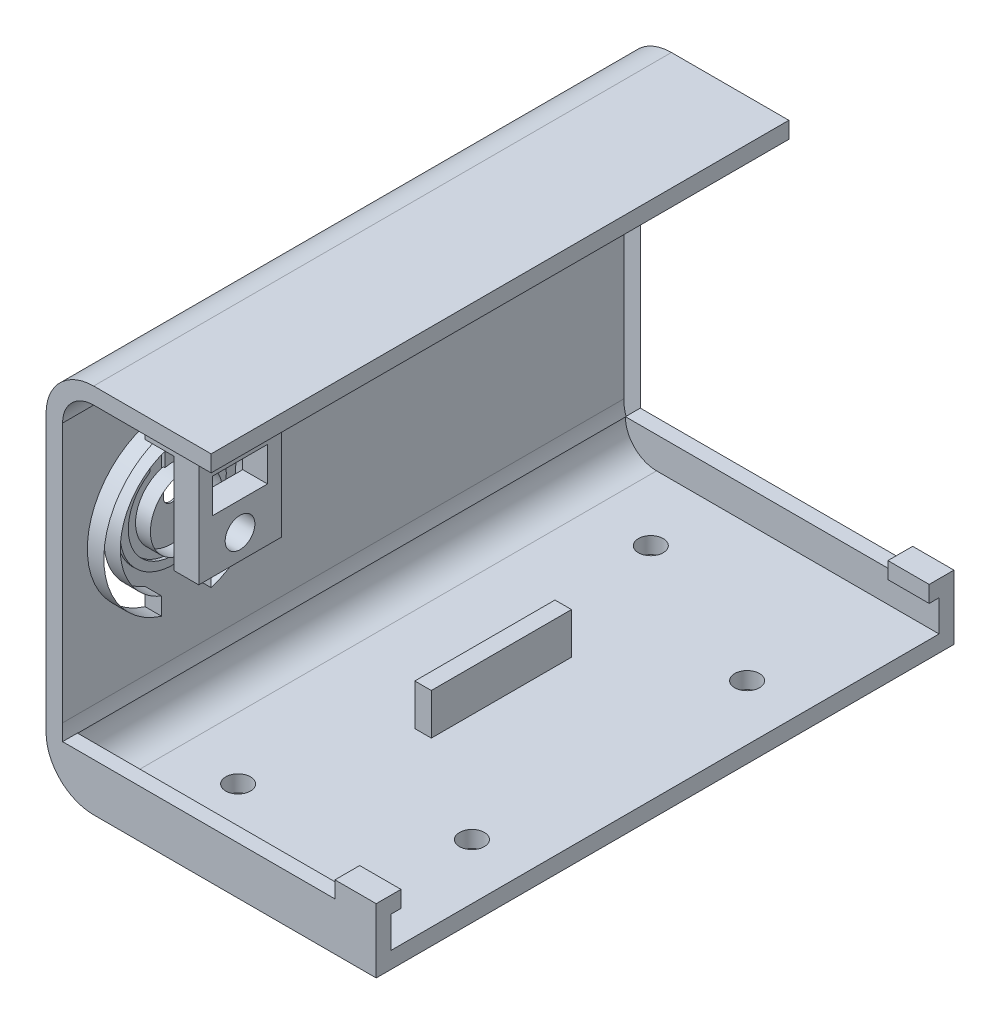
from build123d import *

# Parameters (mm, degrees)
BOSS_EXTRUDE1_DEPTH = 70
BOSS_EXTRUDE3_REACH = 86.63
SKETCH3_W           = 1.8
SKETCH3_H           = 3.8
SKETCH4_W           = 5
SKETCH4_H           = 3
BOSS_EXTRUDE4_DEPTH = 2
CUT_EXTRUDE1_REACH  = 90.595
SKETCH5_R           = 1.5
SKETCH7_R           = 10
CUT_EXTRUDE2_DEPTH  = 85.630140132
BOSS_EXTRUDE5_DEPTH = 2
SKETCH10_R          = 4.358893906
CUT_EXTRUDE3_DEPTH  = 1.8
SKETCH9_R           = 1.5
BOSS_EXTRUDE6_DEPTH = 2
SKETCH11_W          = 10
SKETCH11_H          = 3
BOSS_EXTRUDE7_DEPTH = 3.5
SKETCH12_W          = 10
SKETCH12_H          = 15
BOSS_EXTRUDE8_DEPTH = 3
CUT_EXTRUDE4_REACH  = 82.96
SKETCH13_W          = 6.66
SKETCH13_H          = 4.15
CUT_EXTRUDE5_REACH  = 82.96
SKETCH15_R          = 1.8
CUT_EXTRUDE6_DEPTH  = 0.4
SKETCH17_W          = 2
SKETCH17_H          = 16.984057064
BOSS_EXTRUDE9_DEPTH = 5


with BuildPart() as part:
    # Sketch1 → Boss-Extrude1 (new body)
    with BuildSketch(Plane.XY):
        with BuildLine():
            Line((-30.398230088, 19.964424779), (-30.398230088, -13.495575221))
            ThreePointArc((-30.398230088, -13.495575221), (-28.708236216, -17.575581349), (-24.628230088, -19.265575221))
            Line((-24.628230088, -19.265575221), (9.601769912, -19.265575221))
            Line((9.601769912, -19.265575221), (9.601769912, -17.265575221))
            Line((9.601769912, -17.265575221), (-24.628230088, -17.265575221))
            ThreePointArc((-24.628230088, -17.265575221), (-27.294022654, -16.161367786), (-28.398230088, -13.495575221))
            Line((-28.398230088, -13.495575221), (-28.398230088, 19.964424779))
            ThreePointArc((-28.398230088, 19.964424779), (-27.294022654, 22.630217344), (-24.628230088, 23.734424779))
            Line((-24.628230088, 23.734424779), (-10.398230088, 23.734424779))
            Line((-10.398230088, 23.734424779), (-10.398230088, 25.734424779))
            Line((-10.398230088, 25.734424779), (-24.628230088, 25.734424779))
            ThreePointArc((-24.628230088, 25.734424779), (-28.708236216, 24.044430906), (-30.398230088, 19.964424779))
        make_face()
    extrude(amount=BOSS_EXTRUDE1_DEPTH)

    # Sketch3 → Boss-Extrude3 (add, up to next)
    with BuildSketch(Plane(origin=(9.601769912, 0, 0), x_dir=(0, 0, -1), z_dir=(1, 0, 0)), mode=Mode.PRIVATE) as boss_extrude3_sk1:
        with Locations((-69.1, -15.365575221)):
            Rectangle(SKETCH3_W, SKETCH3_H)
    boss_extrude3_tool1 = extrude(boss_extrude3_sk1.sketch, amount=-BOSS_EXTRUDE3_REACH, mode=Mode.PRIVATE) - part.part
    # Sketch3 → Boss-Extrude3 (add, up to next)
    with BuildSketch(Plane(origin=(9.601769912, 0, 0), x_dir=(0, 0, -1), z_dir=(1, 0, 0)), mode=Mode.PRIVATE) as boss_extrude3_sk2:
        with Locations((-0.9, -15.365575221)):
            Rectangle(SKETCH3_W, SKETCH3_H)
    boss_extrude3_tool2 = extrude(boss_extrude3_sk2.sketch, amount=-BOSS_EXTRUDE3_REACH, mode=Mode.PRIVATE) - part.part
    add(boss_extrude3_tool1.solids().sort_by_distance((9.60177, -15.365575, 69.1))[0])
    add(boss_extrude3_tool2.solids().sort_by_distance((9.60177, -15.365575, 0.9))[0])

    # Sketch4 → Boss-Extrude4 (add)
    with BuildSketch(Plane(origin=(0, -13.465575221, 0), x_dir=(1, 0, 0), z_dir=(0, 1, 0))):
        with Locations((7.101769912, -68.5)):
            Rectangle(SKETCH4_W, SKETCH4_H)
        with Locations((7.101769912, -1.5)):
            Rectangle(SKETCH4_W, SKETCH4_H)
    extrude(amount=BOSS_EXTRUDE4_DEPTH)

    # Sketch5 → Cut-Extrude1 (cut, up to next)
    with BuildSketch(Plane(origin=(0, -19.265575221, 0), x_dir=(-1, 0, 0), z_dir=(0, -1, 0)), mode=Mode.PRIVATE) as cut_extrude1_sk1:
        with Locations((17.128230088, -60)):
            Circle(SKETCH5_R)
    cut_extrude1_tool1 = extrude(cut_extrude1_sk1.sketch, amount=-CUT_EXTRUDE1_REACH, mode=Mode.PRIVATE) & part.part
    # Sketch5 → Cut-Extrude1 (cut, up to next)
    with BuildSketch(Plane(origin=(0, -19.265575221, 0), x_dir=(-1, 0, 0), z_dir=(0, -1, 0)), mode=Mode.PRIVATE) as cut_extrude1_sk2:
        with Locations((17.128230088, -10)):
            Circle(SKETCH5_R)
    cut_extrude1_tool2 = extrude(cut_extrude1_sk2.sketch, amount=-CUT_EXTRUDE1_REACH, mode=Mode.PRIVATE) & part.part
    # Sketch5 → Cut-Extrude1 (cut, up to next)
    with BuildSketch(Plane(origin=(0, -19.265575221, 0), x_dir=(-1, 0, 0), z_dir=(0, -1, 0)), mode=Mode.PRIVATE) as cut_extrude1_sk3:
        with Locations((-2.871769912, -51.67)):
            Circle(SKETCH5_R)
    cut_extrude1_tool3 = extrude(cut_extrude1_sk3.sketch, amount=-CUT_EXTRUDE1_REACH, mode=Mode.PRIVATE) & part.part
    # Sketch5 → Cut-Extrude1 (cut, up to next)
    with BuildSketch(Plane(origin=(0, -19.265575221, 0), x_dir=(-1, 0, 0), z_dir=(0, -1, 0)), mode=Mode.PRIVATE) as cut_extrude1_sk4:
        with Locations((-2.871769912, -18.33)):
            Circle(SKETCH5_R)
    cut_extrude1_tool4 = extrude(cut_extrude1_sk4.sketch, amount=-CUT_EXTRUDE1_REACH, mode=Mode.PRIVATE) & part.part
    add(cut_extrude1_tool1.solids().sort_by_distance((-17.12823, -19.265575, 60))[0], mode=Mode.SUBTRACT)
    add(cut_extrude1_tool2.solids().sort_by_distance((-17.12823, -19.265575, 10))[0], mode=Mode.SUBTRACT)
    add(cut_extrude1_tool3.solids().sort_by_distance((2.87177, -19.265575, 51.67))[0], mode=Mode.SUBTRACT)
    add(cut_extrude1_tool4.solids().sort_by_distance((2.87177, -19.265575, 18.33))[0], mode=Mode.SUBTRACT)

    # Sketch7 → Cut-Extrude2 (cut, through all)
    with BuildSketch(Plane.ZY.offset(30.398230088)):
        with Locations((55, 3.234424779)):
            Circle(SKETCH7_R)
    extrude(amount=-CUT_EXTRUDE2_DEPTH, mode=Mode.SUBTRACT)

    # Sketch8 → Boss-Extrude5 (add)
    with BuildSketch(Plane.ZY.offset(30.398230088)):
        with BuildLine():
            Line((52, -4.181773708), (52, -6.304967235))
            ThreePointArc((52, -6.304967235), (55, -6.765575221), (58, -6.304967235))
            Line((58, -6.304967235), (58, -4.181773708))
            ThreePointArc((58, -4.181773708), (55, 11.234424779), (52, -4.181773708))
        make_face()
    extrude(amount=-BOSS_EXTRUDE5_DEPTH)

    # Sketch10 → Cut-Extrude3 (cut)
    with BuildSketch(Plane(origin=(-28.398230088, 0, 0), x_dir=(0, 0, -1), z_dir=(1, 0, 0))):
        with Locations((-55, 3.234424779)):
            Circle(SKETCH10_R)
    extrude(amount=-CUT_EXTRUDE3_DEPTH, mode=Mode.SUBTRACT)

    # Sketch9 → Boss-Extrude6 (add)
    with BuildSketch(Plane(origin=(-28.398230088, 0, 0), x_dir=(0, 0, -1), z_dir=(1, 0, 0))):
        with Locations((-55, 9.734424779)):
            Circle(SKETCH9_R)
    extrude(amount=BOSS_EXTRUDE6_DEPTH)

    # Sketch11 → Boss-Extrude7 (add)
    with BuildSketch(Plane(origin=(-28.398230088, 0, 0), x_dir=(0, 0, -1), z_dir=(1, 0, 0))):
        with Locations((-55, 14.734424779)):
            Rectangle(SKETCH11_W, SKETCH11_H)
    extrude(amount=BOSS_EXTRUDE7_DEPTH)

    # Sketch12 → Boss-Extrude8 (add)
    with BuildSketch(Plane(origin=(-24.898230088, 0, 0), x_dir=(0, 0, -1), z_dir=(1, 0, 0))):
        with Locations((-55, 8.734424779)):
            Rectangle(SKETCH12_W, SKETCH12_H)
    extrude(amount=BOSS_EXTRUDE8_DEPTH)

    # Sketch13 → Cut-Extrude4 (cut, up to next)
    with BuildSketch(Plane(origin=(-21.898230088, 0, 0), x_dir=(0, 0, -1), z_dir=(1, 0, 0)), mode=Mode.PRIVATE) as cut_extrude4_sk1:
        with Locations((-55, 9.734424779)):
            Rectangle(SKETCH13_W, SKETCH13_H)
    cut_extrude4_tool1 = extrude(cut_extrude4_sk1.sketch, amount=-CUT_EXTRUDE4_REACH, mode=Mode.PRIVATE) & part.part
    add(cut_extrude4_tool1.solids().sort_by_distance((-21.89823, 9.734425, 55))[0], mode=Mode.SUBTRACT)

    # Sketch15 → Cut-Extrude5 (cut, up to next)
    with BuildSketch(Plane(origin=(-21.898230088, 0, 0), x_dir=(0, 0, -1), z_dir=(1, 0, 0)), mode=Mode.PRIVATE) as cut_extrude5_sk1:
        with Locations((-55, 4.234424779)):
            Circle(SKETCH15_R)
    cut_extrude5_tool1 = extrude(cut_extrude5_sk1.sketch, amount=-CUT_EXTRUDE5_REACH, mode=Mode.PRIVATE) & part.part
    add(cut_extrude5_tool1.solids().sort_by_distance((-21.89823, 4.234425, 55))[0], mode=Mode.SUBTRACT)

    # Sketch16 → Cut-Extrude6 (cut)
    with BuildSketch(Plane.ZY.offset(30.398230088)):
        with BuildLine():
            Line((54, 9.234424779), (54, 4.234424779))
            ThreePointArc((54, 4.234424779), (55, 3.234424779), (56, 4.234424779))
            Line((56, 4.234424779), (56, 9.234424779))
            ThreePointArc((56, 9.234424779), (55, 10.234424779), (54, 9.234424779))
        make_face()
        with BuildLine():
            ThreePointArc((51.990895344, 7.766880364), (55, -2.205967162), (58.009104656, 7.766880364))
            ThreePointArc((58.009104656, 7.766880364), (57.869100871, 8.459988538), (58.562209044, 8.599992323))
            ThreePointArc((58.562209044, 8.599992323), (55, -3.205967162), (51.437790956, 8.599992323))
            ThreePointArc((51.437790956, 8.599992323), (52.130899129, 8.459988538), (51.990895344, 7.766880364))
        make_face()
    extrude(amount=-CUT_EXTRUDE6_DEPTH, mode=Mode.SUBTRACT)

    # Sketch17 → Boss-Extrude9 (add)
    with BuildSketch(Plane(origin=(0, -17.265575221, 0), x_dir=(1, 0, 0), z_dir=(0, 1, 0))):
        with Locations((-11.228230088, -35)):
            Rectangle(SKETCH17_W, SKETCH17_H)
    extrude(amount=BOSS_EXTRUDE9_DEPTH)


solid = part.part
